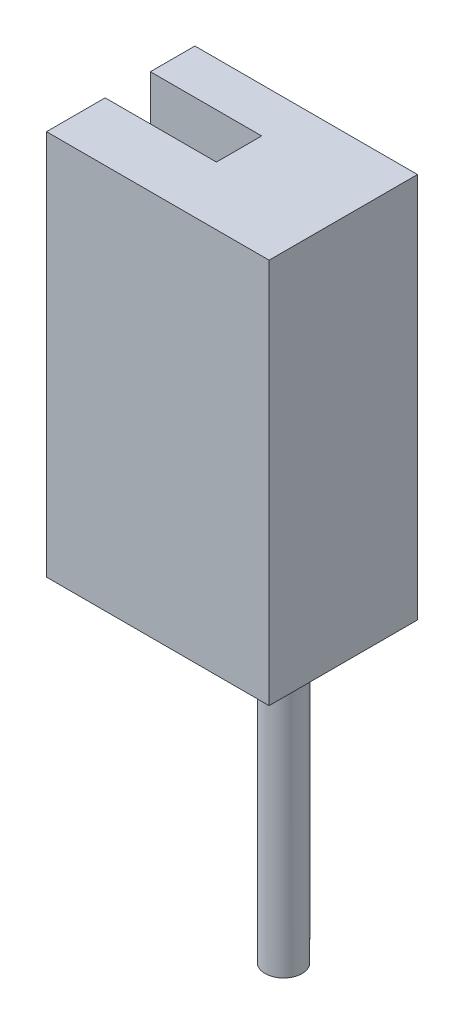
from build123d import *

# Parameters (mm, degrees)
SKETCH1_W           = 30
SKETCH1_H           = 52
BOSS_EXTRUDE1_DEPTH = 20
SKETCH3_W           = 15
SKETCH3_H           = 6.1
CUT_EXTRUDE1_DEPTH  = 69.886771008
SKETCH4_R           = 2.5
BOSS_EXTRUDE2_DEPTH = 40


with BuildPart() as part:
    # Sketch1 → Boss-Extrude1 (new body)
    with BuildSketch(Plane.XY):
        with Locations((25.514037319, -26)):
            Rectangle(SKETCH1_W, SKETCH1_H)
    extrude(amount=BOSS_EXTRUDE1_DEPTH)

    # Sketch3 → Cut-Extrude1 (cut, through all)
    with BuildSketch(Plane(origin=(0, 0, 0), x_dir=(1, 0, 0), z_dir=(0, 1, 0))):
        with Locations((18.014037319, -9.05)):
            Rectangle(SKETCH3_W, SKETCH3_H)
    extrude(amount=-CUT_EXTRUDE1_DEPTH, mode=Mode.SUBTRACT)

    # Sketch4 → Boss-Extrude2 (add)
    with BuildSketch(Plane(origin=(0, -52, 0), x_dir=(-1, 0, 0), z_dir=(0, -1, 0))):
        with Locations((-31.514037319, -9.05)):
            Circle(SKETCH4_R)
    extrude(amount=BOSS_EXTRUDE2_DEPTH)


solid = part.part
